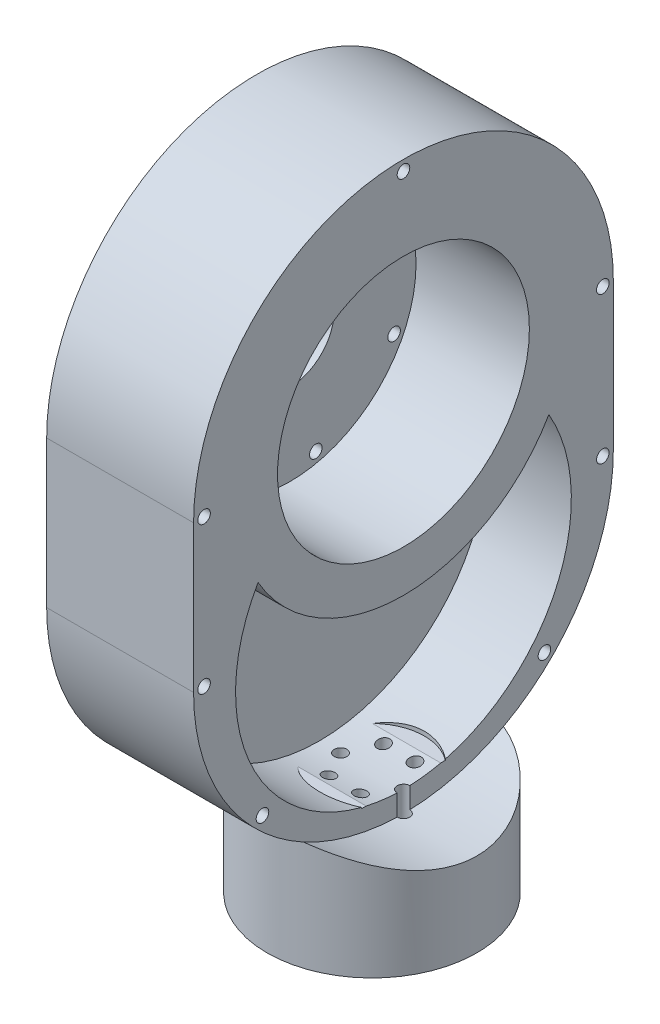
from build123d import *

# Parameters (mm, degrees)
SALIENTE_EXTRUIR3_DEPTH      = 27.5
SALIENTE_EXTRUIR4_REACH      = 167.17
SALIENTE_EXTRUIR4_END_RADIUS = 50
CROQUIS2_R                   = 25
CROQUIS5_R                   = 45
CROQUIS5_R_2                 = 32.5
CORTAR_EXTRUIR2_DEPTH        = 1.5
CROQUIS6_R                   = 10.5
CORTAR_EXTRUIR3_DEPTH        = 172.901134438
CORTAR_EXTRUIR4_DEPTH        = 20
CROQUIS8_R                   = 30
CORTAR_EXTRUIR5_DEPTH        = 27
CROQUIS9_R                   = 1.5
CORTAR_EXTRUIR7_DEPTH        = 30
CROQUIS10_R                  = 12.5
CORTAR_EXTRUIR8_DEPTH        = 5
CROQUIS11_R                  = 1.5
CORTAR_EXTRUIR9_DEPTH        = 172.117649646
CORTAR_EXTRUIR10_DEPTH       = 20
CROQUIS13_R                  = 1.5
CORTAR_EXTRUIR11_DEPTH       = 167.583312541
CROQUIS14_R                  = 17.5
CROQUIS14_R_2                = 10
CORTAR_EXTRUIR12_DEPTH       = 2
CROQUIS15_R                  = 13.5
CROQUIS15_R_2                = 10
CORTAR_EXTRUIR13_DEPTH       = 4


with BuildPart() as part:
    # Croquis3 → Saliente-Extruir3 (new, symmetric)
    with BuildSketch(Plane(origin=(0, 0, 0), x_dir=(0, 0, -1), z_dir=(1, 0, 0))):
        with BuildLine():
            Line((-50, 105), (-50, 70))
            ThreePointArc((-50, 70), (0, 20), (50, 70))
            Line((50, 70), (50, 105))
            ThreePointArc((50, 105), (0, 155), (-50, 105))
        make_face()
    extrude(amount=SALIENTE_EXTRUIR3_DEPTH, both=True)

    # Saliente-Extruir4: up to this cylinder (the profile starts outside it)
    saliente_extruir4_end = Plane(origin=(0, 70, 0), z_dir=(-1, 0, 0)) * Cylinder(SALIENTE_EXTRUIR4_END_RADIUS, 435.34, mode=Mode.PRIVATE)
    # Croquis2 → Saliente-Extruir4 (add, up to the surface)
    with BuildSketch(Plane(origin=(0, 0, 0), x_dir=(1, 0, 0), z_dir=(0, 1, 0)), mode=Mode.PRIVATE) as saliente_extruir4_sk1:
        with Locations(Location((0, 0, 0), (0, 0, 90))):
            Circle(CROQUIS2_R)
    saliente_extruir4_tool1 = extrude(saliente_extruir4_sk1.sketch, amount=SALIENTE_EXTRUIR4_REACH, mode=Mode.PRIVATE) - saliente_extruir4_end
    add(saliente_extruir4_tool1.solids().sort_by_distance((0, 0, 0))[0])

    # Croquis5 → Cortar-Extruir2 (cut)
    with BuildSketch(Plane.ZY.offset(27.5)):
        with Locations((0, 105)):
            Circle(CROQUIS5_R)
        with Locations((0, 105)):
            Circle(CROQUIS5_R_2, mode=Mode.SUBTRACT)
    extrude(amount=-CORTAR_EXTRUIR2_DEPTH, mode=Mode.SUBTRACT)

    # Croquis6 → Cortar-Extruir3 (cut, through all)
    with BuildSketch(Plane.ZY.offset(27.5)):
        with Locations((0, 105)):
            Circle(CROQUIS6_R)
    extrude(amount=-CORTAR_EXTRUIR3_DEPTH, mode=Mode.SUBTRACT)

    # Croquis7 → Cortar-Extruir4 (cut)
    with BuildSketch(Plane(origin=(27.5, 0, 0), x_dir=(0, 0, -1), z_dir=(1, 0, 0))):
        with BuildLine():
            Line((-50, 105), (-50, 70))
            ThreePointArc((-50, 70), (0, 20), (50, 70))
            Line((50, 70), (50, 105))
            ThreePointArc((50, 105), (0, 155), (-50, 105))
        make_face()
    extrude(amount=-CORTAR_EXTRUIR4_DEPTH, mode=Mode.SUBTRACT)

    # Croquis8 → Cortar-Extruir5 (cut)
    with BuildSketch(Plane(origin=(7.5, 0, 0), x_dir=(0, 0, -1), z_dir=(1, 0, 0))):
        with Locations((0, 105)):
            Circle(CROQUIS8_R)
    extrude(amount=-CORTAR_EXTRUIR5_DEPTH, mode=Mode.SUBTRACT)

    # Croquis9 → Cortar-Extruir7 (cut)
    with BuildSketch(Plane.XZ):
        with Locations(Location((7.5, 0, 0), (0, 0, 270))):
            Circle(CROQUIS9_R)
        with Locations(Location((3.75, -6.495190528, 0), (0, 0, 270))):
            Circle(CROQUIS9_R)
        with Locations(Location((-3.75, -6.495190528, 0), (0, 0, 270))):
            Circle(CROQUIS9_R)
        with Locations(Location((-7.5, 0, 0), (0, 0, 270))):
            Circle(CROQUIS9_R)
        with Locations(Location((-3.75, 6.495190528, 0), (0, 0, 270))):
            Circle(CROQUIS9_R)
        with Locations(Location((3.75, 6.495190528, 0), (0, 0, 270))):
            Circle(CROQUIS9_R)
    extrude(amount=-CORTAR_EXTRUIR7_DEPTH, mode=Mode.SUBTRACT)

    # Croquis10 → Cortar-Extruir8 (cut)
    with BuildSketch(Plane(origin=(0, 26, 0), x_dir=(1, 0, 0), z_dir=(0, 1, 0))):
        Circle(CROQUIS10_R)
    extrude(amount=CORTAR_EXTRUIR8_DEPTH, mode=Mode.SUBTRACT)

    # Croquis11 → Cortar-Extruir9 (cut, through all)
    with BuildSketch(Plane.ZY.offset(27.5)):
        with Locations((27.5, 105)):
            Circle(CROQUIS11_R)
        with Locations((17.145969551, 83.499634232)):
            Circle(CROQUIS11_R)
        with Locations((-6.119325684, 78.189482415)):
            Circle(CROQUIS11_R)
        with Locations((-24.776643867, 93.068197174)):
            Circle(CROQUIS11_R)
        with Locations((-24.776643867, 116.931802826)):
            Circle(CROQUIS11_R)
        with Locations((-6.119325684, 131.810517585)):
            Circle(CROQUIS11_R)
        with Locations((17.145969551, 126.500365768)):
            Circle(CROQUIS11_R)
    extrude(amount=-CORTAR_EXTRUIR9_DEPTH, mode=Mode.SUBTRACT)

    # Croquis12 → Cortar-Extruir10 (cut)
    with BuildSketch(Plane(origin=(7.5, 0, 0), x_dir=(0, 0, -1), z_dir=(1, 0, 0))):
        with BuildLine():
            ThreePointArc((-34.641016151, 85), (0, 25), (34.641016151, 85))
            ThreePointArc((34.641016151, 85), (0, 65), (-34.641016151, 85))
        make_face()
    extrude(amount=-CORTAR_EXTRUIR10_DEPTH, mode=Mode.SUBTRACT)

    # Croquis13 → Cortar-Extruir11 (cut, through all)
    with BuildSketch(Plane(origin=(7.5, 0, 0), x_dir=(0, 0, -1), z_dir=(1, 0, 0))):
        with Locations((0, 152.5)):
            Circle(CROQUIS13_R)
        with Locations((47.5, 105)):
            Circle(CROQUIS13_R)
        with Locations((-47.5, 105)):
            Circle(CROQUIS13_R)
        with Locations((-47.5, 70)):
            Circle(CROQUIS13_R)
        with Locations((47.5, 70)):
            Circle(CROQUIS13_R)
        with Locations((33.587572106, 36.412427894)):
            Circle(CROQUIS13_R)
        with Locations((-33.587572106, 36.412427894)):
            Circle(CROQUIS13_R)
    extrude(amount=-CORTAR_EXTRUIR11_DEPTH, mode=Mode.SUBTRACT)

    # Croquis14 → Cortar-Extruir12 (cut)
    with BuildSketch(Plane.XZ):
        with Locations(Location((0, 0, 0), (0, 0, 270))):
            Circle(CROQUIS14_R)
        with Locations(Location((0, 0, 0), (0, 0, 270))):
            Circle(CROQUIS14_R_2, mode=Mode.SUBTRACT)
    extrude(amount=-CORTAR_EXTRUIR12_DEPTH, mode=Mode.SUBTRACT)

    # Croquis15 → Cortar-Extruir13 (cut)
    with BuildSketch(Plane.ZY.offset(27.5)):
        with Locations((0, 105)):
            Circle(CROQUIS15_R)
        with Locations((0, 105)):
            Circle(CROQUIS15_R_2, mode=Mode.SUBTRACT)
    extrude(amount=-CORTAR_EXTRUIR13_DEPTH, mode=Mode.SUBTRACT)


solid = part.part
